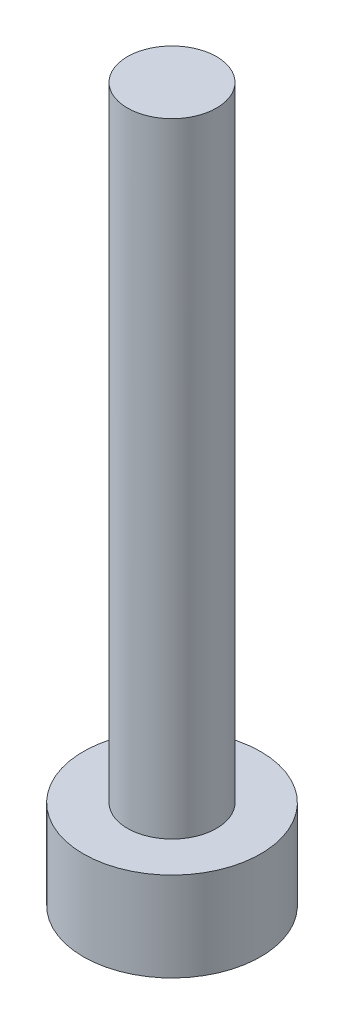
from build123d import *

# Parameters (mm, degrees)
SKETCH_1_R      = 1
EXTRUDE_1_DEPTH = 14
SKETCH_2_R      = 1.99
EXTRUDE_2_DEPTH = 2


with BuildPart() as part:
    # 草图1 → 凸台-拉伸1 (new body)
    with BuildSketch(Plane(origin=(0, 0, 0), x_dir=(1, 0, 0), z_dir=(0, 1, 0))):
        with Locations(Location((0, 0, 0), (0, 0, 270))):
            Circle(SKETCH_1_R)
    extrude(amount=EXTRUDE_1_DEPTH)

    # 草图2 → 凸台-拉伸2 (add)
    with BuildSketch(Plane.XZ):
        with Locations(Location((0, 0, 0), (0, 0, 270))):
            Circle(SKETCH_2_R)
    extrude(amount=EXTRUDE_2_DEPTH)


solid = part.part
